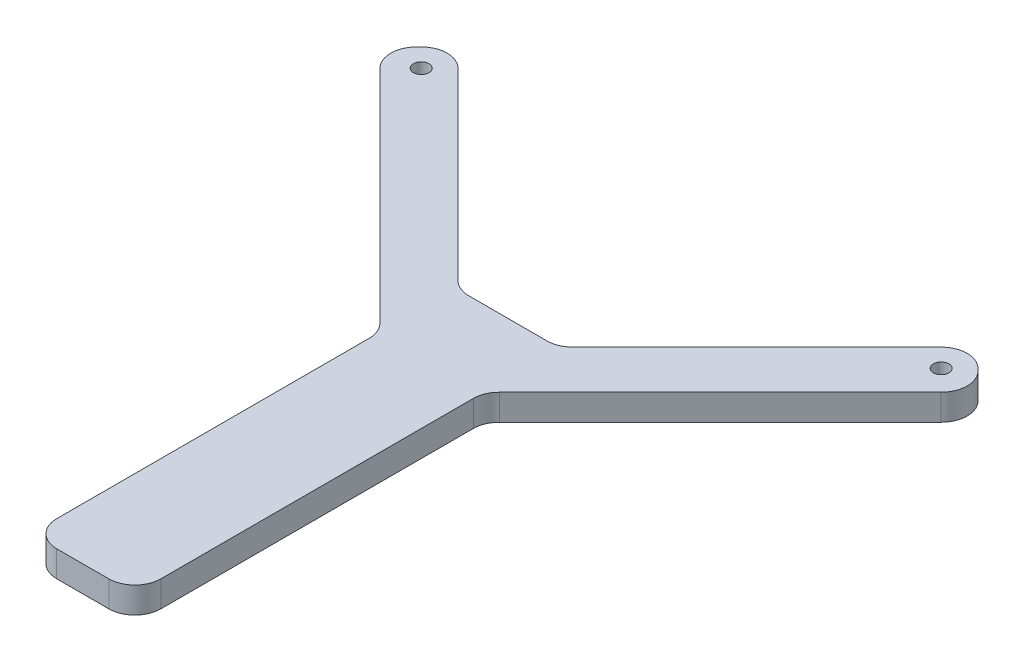
from build123d import *

# Parameters (mm, degrees)
SKETCH1_R           = 3.81
BOSS_EXTRUDE1_DEPTH = 12.7


with BuildPart() as part:
    # Sketch1 → Boss-Extrude1 (new body)
    with BuildSketch(Plane(origin=(0, 0, 0), x_dir=(1, 0, 0), z_dir=(0, 1, 0))):
        with BuildLine():
            Line((-3.719743879, 3.719743879), (-111.482817332, 111.482817332))
            ThreePointArc((-111.482817332, 111.482817332), (-115.202561211, 120.463073453), (-111.482817332, 129.443329574))
            Line((-111.482817332, 129.443329574), (-110.393329574, 130.532817332))
            ThreePointArc((-110.393329574, 130.532817332), (-101.413073453, 134.252561211), (-92.432817332, 130.532817332))
            Line((-92.432817332, 130.532817332), (-2.630256121, 40.730256121))
            ThreePointArc((-2.630256121, 40.730256121), (1.489920409, 37.977242179), (6.35, 37.010512242))
            Line((6.35, 37.010512242), (44.45, 37.010512242))
            ThreePointArc((44.45, 37.010512242), (49.310079591, 37.977242179), (53.430256121, 40.730256121))
            Line((53.430256121, 40.730256121), (143.232817332, 130.532817332))
            ThreePointArc((143.232817332, 130.532817332), (152.213073453, 134.252561211), (161.193329574, 130.532817332))
            Line((161.193329574, 130.532817332), (162.282817332, 129.443329574))
            ThreePointArc((162.282817332, 129.443329574), (166.002561211, 120.463073453), (162.282817332, 111.482817332))
            Line((162.282817332, 111.482817332), (54.519743879, 3.719743879))
            ThreePointArc((54.519743879, 3.719743879), (51.766729937, -0.400432651), (50.8, -5.260512242))
            Line((50.8, -5.260512242), (50.8, -157.660512242))
            ThreePointArc((50.8, -157.660512242), (47.080256121, -166.640768363), (38.1, -170.360512242))
            Line((38.1, -170.360512242), (12.7, -170.360512242))
            ThreePointArc((12.7, -170.360512242), (3.719743879, -166.640768363), (0, -157.660512242))
            Line((0, -157.660512242), (0, -5.260512242))
            ThreePointArc((0, -5.260512242), (-0.966729937, -0.400432651), (-3.719743879, 3.719743879))
        make_face()
        with Locations(Location((152.213073453, 121.552561211, 0), (0, 0, 270))):
            Circle(SKETCH1_R, mode=Mode.SUBTRACT)
        with Locations(Location((-101.413073453, 121.552561211, 0), (0, 0, 270))):
            Circle(SKETCH1_R, mode=Mode.SUBTRACT)
    extrude(amount=BOSS_EXTRUDE1_DEPTH)


solid = part.part
